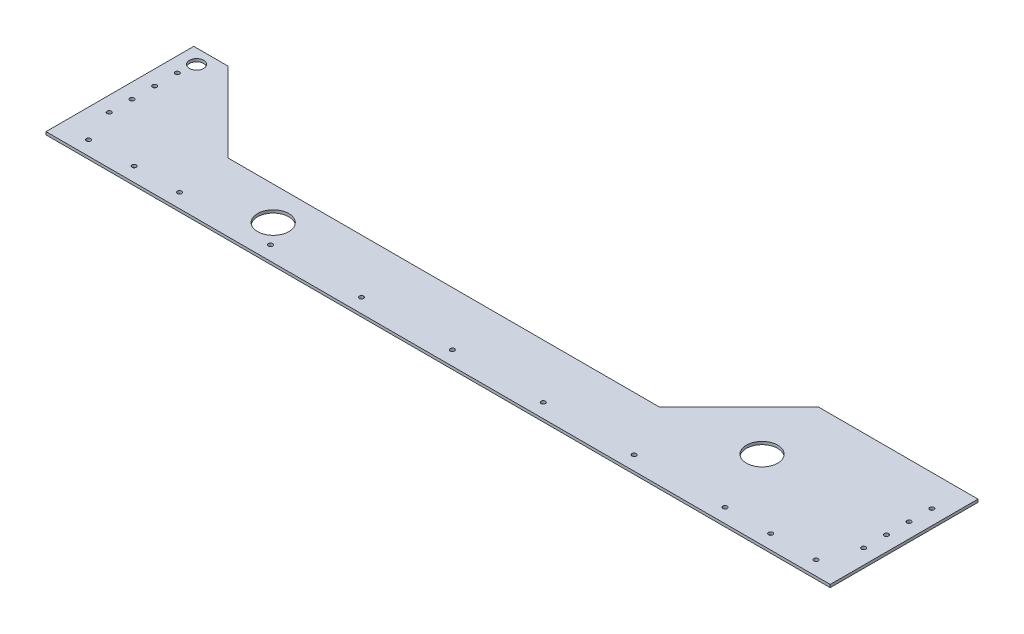
from build123d import *

# Parameters (mm, degrees)
SKETCH1_R           = 17.4625
SKETCH1_R_2         = 2.4257
SKETCH1_R_3         = 7.9375
BOSS_EXTRUDE1_DEPTH = 3.175


with BuildPart() as part:
    # Sketch1 → Boss-Extrude1 (new body)
    with BuildSketch(Plane(origin=(0, 0, 0), x_dir=(1, 0, 0), z_dir=(0, 1, 0))):
        Polygon((0, 0), (876.3, 0), (876.3, 165.1), (698.5, 165.1), (609.6, 76.2), (127, 76.2), (38.1, 165.1), (0, 165.1), align=None)
        with Locations(Location((214.9475, 38.9255, 0), (0, 0, 270))):
            Circle(SKETCH1_R, mode=Mode.SUBTRACT)
        with Locations(Location((712.16774, 87.9475, 0), (0, 0, 270))):
            Circle(SKETCH1_R, mode=Mode.SUBTRACT)
        with Locations(Location((438.15, 15.875, 0), (0, 0, 270))):
            Circle(SKETCH1_R_2, mode=Mode.SUBTRACT)
        with Locations(Location((539.75, 15.875, 0), (0, 0, 270))):
            Circle(SKETCH1_R_2, mode=Mode.SUBTRACT)
        with Locations(Location((641.35, 15.875, 0), (0, 0, 270))):
            Circle(SKETCH1_R_2, mode=Mode.SUBTRACT)
        with Locations(Location((742.95, 15.875, 0), (0, 0, 270))):
            Circle(SKETCH1_R_2, mode=Mode.SUBTRACT)
        with Locations(Location((844.55, 15.875, 0), (0, 0, 270))):
            Circle(SKETCH1_R_2, mode=Mode.SUBTRACT)
        with Locations(Location((31.75, 15.875, 0), (0, 0, 270))):
            Circle(SKETCH1_R_2, mode=Mode.SUBTRACT)
        with Locations(Location((133.35, 15.875, 0), (0, 0, 270))):
            Circle(SKETCH1_R_2, mode=Mode.SUBTRACT)
        with Locations(Location((234.95, 15.875, 0), (0, 0, 270))):
            Circle(SKETCH1_R_2, mode=Mode.SUBTRACT)
        with Locations(Location((336.55, 15.875, 0), (0, 0, 270))):
            Circle(SKETCH1_R_2, mode=Mode.SUBTRACT)
        with Locations(Location((16.637, 53.975, 0), (0, 0, 270))):
            Circle(SKETCH1_R_2, mode=Mode.SUBTRACT)
        with Locations(Location((16.637, 79.375, 0), (0, 0, 270))):
            Circle(SKETCH1_R_2, mode=Mode.SUBTRACT)
        with Locations(Location((16.637, 104.775, 0), (0, 0, 270))):
            Circle(SKETCH1_R_2, mode=Mode.SUBTRACT)
        with Locations(Location((16.637, 130.175, 0), (0, 0, 270))):
            Circle(SKETCH1_R_2, mode=Mode.SUBTRACT)
        with Locations(Location((859.663, 53.975, 0), (0, 0, 270))):
            Circle(SKETCH1_R_2, mode=Mode.SUBTRACT)
        with Locations(Location((859.663, 79.375, 0), (0, 0, 270))):
            Circle(SKETCH1_R_2, mode=Mode.SUBTRACT)
        with Locations(Location((859.663, 104.775, 0), (0, 0, 270))):
            Circle(SKETCH1_R_2, mode=Mode.SUBTRACT)
        with Locations(Location((859.663, 130.175, 0), (0, 0, 270))):
            Circle(SKETCH1_R_2, mode=Mode.SUBTRACT)
        with Locations(Location((82.55, 15.875, 0), (0, 0, 270))):
            Circle(SKETCH1_R_2, mode=Mode.SUBTRACT)
        with Locations(Location((793.75, 15.875, 0), (0, 0, 270))):
            Circle(SKETCH1_R_2, mode=Mode.SUBTRACT)
        with Locations(Location((19.05, 149.225, 0), (0, 0, 270))):
            Circle(SKETCH1_R_3, mode=Mode.SUBTRACT)
    extrude(amount=BOSS_EXTRUDE1_DEPTH)


solid = part.part
